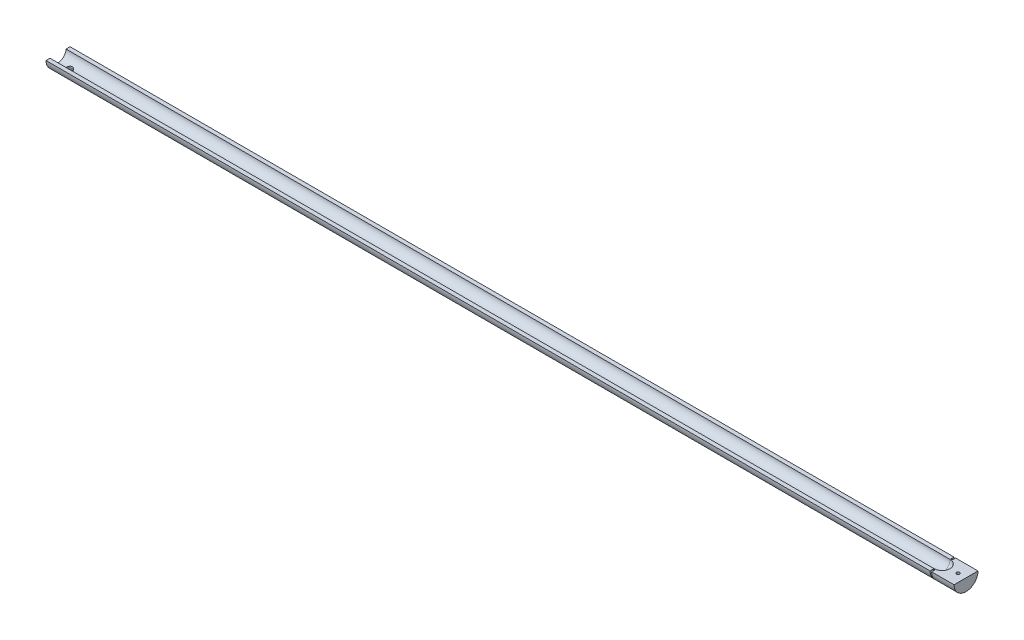
from build123d import *

# Parameters (mm, degrees)
SKETCH1_W                     = 1803.4
SKETCH1_H                     = 57.15
WOOD_BLOCK_DEPTH              = 28.575
SKETCH5_R                     = 6.35
MOUTHPIECE_THROUGH_HOLE_DEPTH = 1805.531577204
SKETCH6_R                     = 3.175
DOWEL_PIN_HOLE_DEPTH          = 15.24
SKETCH8_R                     = 8.128
CUT_EXTRUDE1_DEPTH            = 10.3124
SKETCH3_OUTSIDE_W             = 420.056
SKETCH3_OUTSIDE_H             = 391.481
SKETCH3_OUTSIDE_R             = 23.8125
OUTER_DIAMETER_DEPTH          = 1805.531577305
SKETCH7_W                     = 3.175
SKETCH7_H                     = 6.35


with BuildPart() as part:
    # Sketch1 → wood block (new body)
    with BuildSketch(Plane(origin=(0, 0, 0), x_dir=(1, 0, 0), z_dir=(0, 1, 0))):
        with Locations((901.7, 28.575)):
            Rectangle(SKETCH1_W, SKETCH1_H)
    extrude(amount=WOOD_BLOCK_DEPTH)

    # Sketch2 → inner bore (revolve, cut)
    with BuildSketch(Plane.XY.offset(-28.575)):
        with BuildLine():
            Line((1771.65, 28.575), (-15.875, 28.575))
            ThreePointArc((-15.875, 28.575), (-11.225320151, 17.349679849), (0, 12.7))
            Line((0, 12.7), (1755.775, 12.7))
            ThreePointArc((1755.775, 12.7), (1767.000320151, 17.349679849), (1771.65, 28.575))
        make_face()
    revolve(axis=Axis((1771.65, 28.575, -28.575), (-1, 0, 0)), mode=Mode.SUBTRACT)

    # Sketch5 → mouthpiece through hole (cut, through all)
    with BuildSketch(Plane(origin=(0, 0, 0), x_dir=(1, 0, 0), z_dir=(0, 1, 0))):
        with Locations(Location((22.225, 28.575, 0), (0, 0, 90))):
            Circle(SKETCH5_R)
    extrude(amount=MOUTHPIECE_THROUGH_HOLE_DEPTH, mode=Mode.SUBTRACT)

    # Sketch6 → dowel pin hole (cut)
    with BuildSketch(Plane(origin=(0, 28.575, 0), x_dir=(1, 0, 0), z_dir=(0, 1, 0))):
        with Locations(Location((1787.525, 28.575, 0), (0, 0, 270))):
            Circle(SKETCH6_R)
    extrude(amount=-DOWEL_PIN_HOLE_DEPTH, mode=Mode.SUBTRACT)

    # Sketch8 → Cut-Extrude1 (cut)
    with BuildSketch(Plane.XZ):
        with Locations(Location((22.225, -28.575, 0), (0, 0, 270))):
            Circle(SKETCH8_R)
        with Locations(Location((713.359, -28.575, 0), (0, 0, 270))):
            Circle(SKETCH8_R)
    extrude(amount=-CUT_EXTRUDE1_DEPTH, mode=Mode.SUBTRACT)

    # Sketch3 outside → outer diameter (cut, through all)
    with BuildSketch(Plane(origin=(1803.4, 0, 0), x_dir=(0, 0, -1), z_dir=(1, 0, 0))):
        with Locations((28.575, 14.2875)):
            Rectangle(SKETCH3_OUTSIDE_W, SKETCH3_OUTSIDE_H)
        with Locations((28.575, 28.575)):
            Circle(SKETCH3_OUTSIDE_R, mode=Mode.SUBTRACT)
    extrude(amount=-OUTER_DIAMETER_DEPTH, mode=Mode.SUBTRACT)

    # Sketch7 → end length locator (revolve, cut)
    with BuildSketch(Plane(origin=(0, 28.575, 0), x_dir=(1, 0, 0), z_dir=(0, 1, 0))):
        with Locations((1757.3625, 7.9375)):
            Rectangle(SKETCH7_W, SKETCH7_H)
    revolve(axis=Axis((0, 28.575, -28.575), (1, 0, 0)), mode=Mode.SUBTRACT)


solid = part.part
